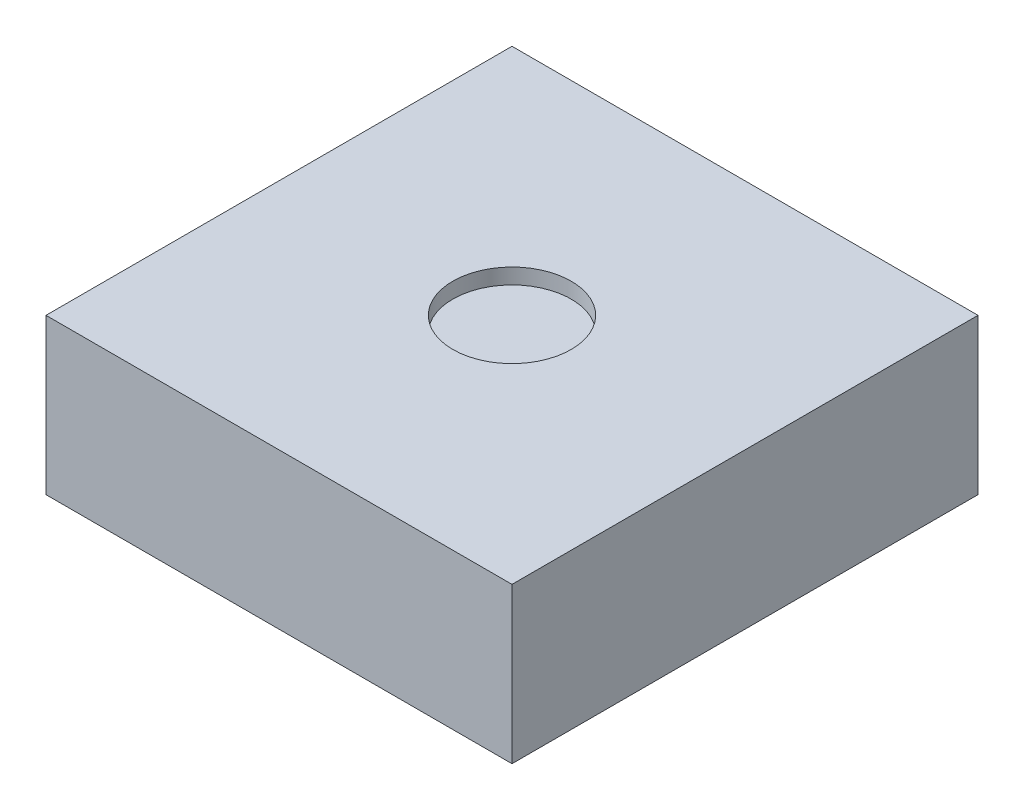
from build123d import *

# Parameters (mm, degrees)
SKETCH1_W           = 30
SKETCH1_H           = 30
BOSS_EXTRUDE1_DEPTH = 10
SKETCH2_R           = 3.81
BORE_DEPTH          = 1


with BuildPart() as part:
    # Sketch1 → Boss-Extrude1 (new body)
    with BuildSketch(Plane(origin=(0, 0, 0), x_dir=(1, 0, 0), z_dir=(0, 1, 0))):
        Rectangle(SKETCH1_W, SKETCH1_H)
    extrude(amount=BOSS_EXTRUDE1_DEPTH)

    # Sketch2 → bore (cut)
    with BuildSketch(Plane(origin=(0, 10, 0), x_dir=(1, 0, 0), z_dir=(0, 1, 0))):
        with Locations(Location((0, 0, 0), (0, 0, 270))):
            Circle(SKETCH2_R)
    extrude(amount=-BORE_DEPTH, mode=Mode.SUBTRACT)


solid = part.part
